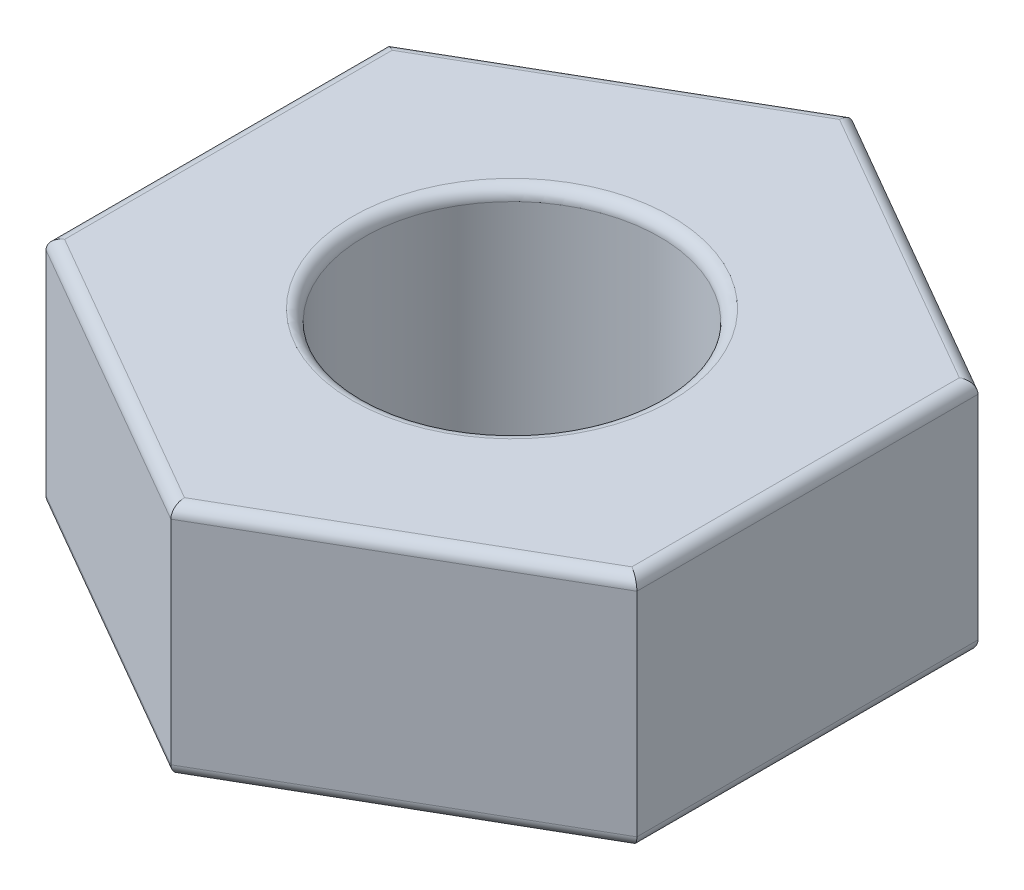
from build123d import *

# Parameters (mm, degrees)
SKETCH1_R           = 1.25
BOSS_EXTRUDE1_DEPTH = 1
FILLET1_R           = 0.1


with BuildPart() as part:
    # Sketch1 → Boss-Extrude1 (new, symmetric)
    with BuildSketch(Plane(origin=(0, 0, 0), x_dir=(1, 0, 0), z_dir=(0, 1, 0))):
        Polygon((0, 2.886751346), (-2.5, 1.443375673), (-2.5, -1.443375673), (0, -2.886751346), (2.5, -1.443375673), (2.5, 1.443375673), align=None)
        with Locations(Location((0, 0, 0), (0, 0, 270))):
            Circle(SKETCH1_R, mode=Mode.SUBTRACT)
    extrude(amount=BOSS_EXTRUDE1_DEPTH, both=True)

    # Fillet1
    fillet1_edges = [part.edges().sort_by_distance(p)[0] for p in [
        (-2.5, 1, 0),
        (-1.25, 1, 2.165063509),
        (1.25, 1, 2.165063509),
        (0, -1, -1.25),
        (0, 1, -1.25),
        (2.5, 1, 0),
        (1.25, 1, -2.165063509),
        (2.5, -1, 0),
        (1.25, -1, 2.165063509),
        (-1.25, -1, 2.165063509),
        (-1.25, 1, -2.165063509),
        (-2.5, -1, 0),
        (-1.25, -1, -2.165063509),
        (1.25, -1, -2.165063509),
    ]]
    fillet(fillet1_edges, radius=FILLET1_R)


solid = part.part
